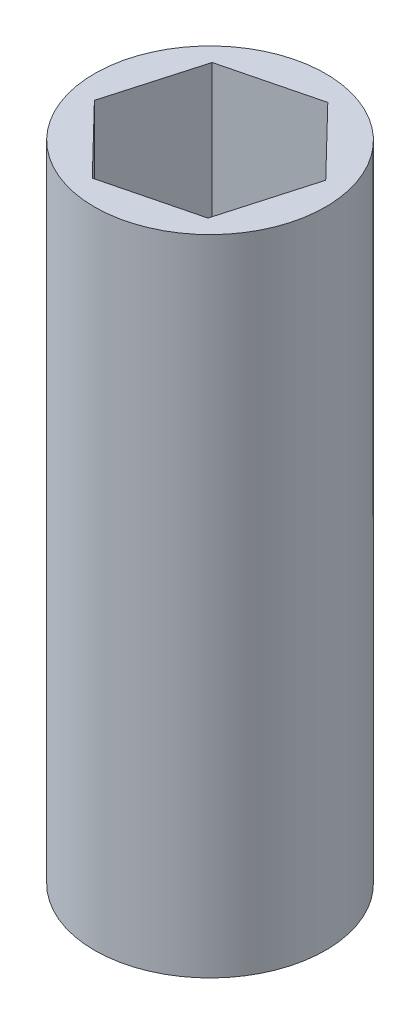
from build123d import *

# Parameters (mm, degrees)
SKETCH1_R           = 8.89
BOSS_EXTRUDE1_DEPTH = 49.53


with BuildPart() as part:
    # Sketch1 → Boss-Extrude1 (new body)
    with BuildSketch(Plane(origin=(0, 0, 0), x_dir=(1, 0, 0), z_dir=(0, 1, 0))):
        with Locations(Location((0, 0, 0), (0, 0, 270))):
            Circle(SKETCH1_R)
        Polygon((2.007551417, 7.052167797), (-5.103580756, 5.264674425), (-7.111132173, -1.787493372), (-2.007551417, -7.052167797), (5.103580756, -5.264674425), (7.111132173, 1.787493372), align=None, mode=Mode.SUBTRACT)
    extrude(amount=BOSS_EXTRUDE1_DEPTH)


solid = part.part
